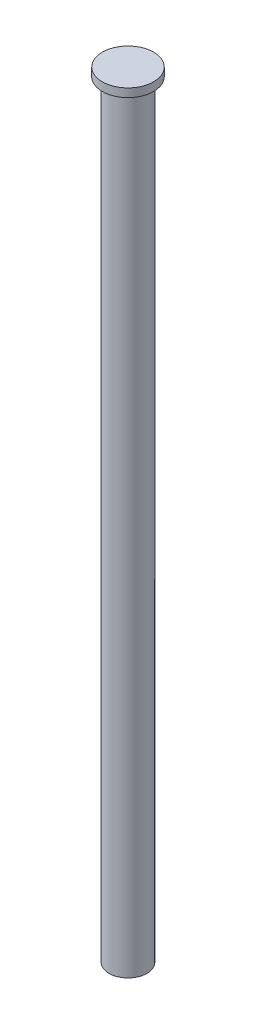
from build123d import *

# Parameters (mm, degrees)
SKETCH1_R           = 22.5
BOSS_EXTRUDE1_DEPTH = 910
SKETCH2_R           = 30.449809799
BOSS_EXTRUDE2_DEPTH = 10


with BuildPart() as part:
    # Sketch1 → Boss-Extrude1 (new body)
    with BuildSketch(Plane(origin=(0, 0, 0), x_dir=(1, 0, 0), z_dir=(0, 1, 0))):
        with Locations(Location((0, 0, 0), (0, 0, 90))):
            Circle(SKETCH1_R)
    extrude(amount=BOSS_EXTRUDE1_DEPTH)

    # Sketch2 → Boss-Extrude2 (add)
    with BuildSketch(Plane(origin=(0, 910, 0), x_dir=(1, 0, 0), z_dir=(0, 1, 0))):
        with Locations(Location((0, 0, 0), (0, 0, 270))):
            Circle(SKETCH2_R)
    extrude(amount=BOSS_EXTRUDE2_DEPTH)


solid = part.part
